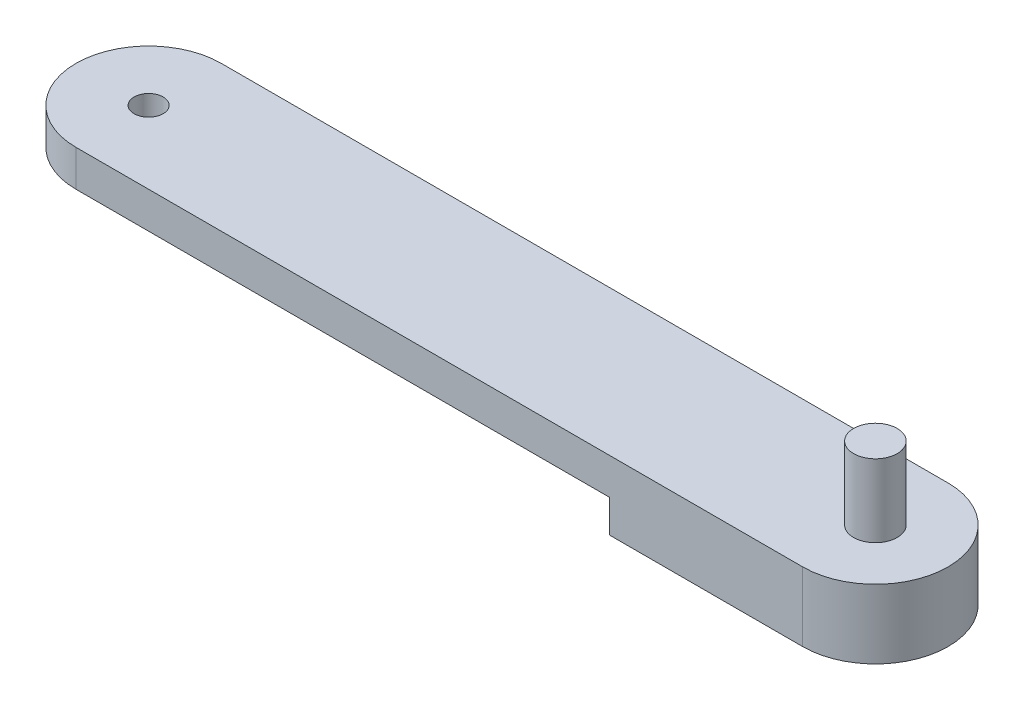
from build123d import *

# Parameters (mm, degrees)
SKETCH_1_R          = 2
EXTRUDE_1_DEPTH     = 5
SKETCH_2_R          = 3
EXTRUDE_2_DEPTH     = 10
EXTRUDE_START       = 4.5
EXTRUDE_3_DEPTH     = 4.5
CUT_EXTRUDE_1_DEPTH = 4.5


with BuildPart() as part:
    # 草图1 → 凸台-拉伸1 (new body)
    with BuildSketch(Plane(origin=(0, 0, 0), x_dir=(1, 0, 0), z_dir=(0, 1, 0))):
        with BuildLine():
            Line((0, 10), (100, 10))
            ThreePointArc((100, 10), (110, 0), (100, -10))
            Line((100, -10), (0, -10))
            ThreePointArc((0, -10), (-10, 0), (0, 10))
        make_face()
        with Locations(Location((0, 0, 0), (0, 0, 270))):
            Circle(SKETCH_1_R, mode=Mode.SUBTRACT)
    extrude(amount=EXTRUDE_1_DEPTH)

    # 草图2 → 凸台-拉伸2 (add)
    with BuildSketch(Plane(origin=(0, 5, 0), x_dir=(1, 0, 0), z_dir=(0, 1, 0))):
        with Locations(Location((100, 0, 0), (0, 0, 270))):
            Circle(SKETCH_2_R)
    extrude(amount=EXTRUDE_2_DEPTH)

    # 草图3 → 凸台-拉伸3 (add)
    with BuildSketch(Plane.XZ.offset(EXTRUDE_START)):
        with BuildLine():
            Line((100, 10), (73.40776322, 10))
            Line((73.40776322, 10), (73.40776322, -10))
            Line((73.40776322, -10), (100, -10))
            ThreePointArc((100, -10), (110, 0), (100, 10))
        make_face()
    extrude(amount=-EXTRUDE_3_DEPTH)

    # 草图4 → 切除-拉伸1 (cut)
    with BuildSketch(Plane.XZ.offset(4.5)):
        with BuildLine():
            Line((79.849230428, 2.288593229), (99.690178504, 3.236180981))
            ThreePointArc((99.690178504, 3.236180981), (103.250977807, 0), (99.690178504, -3.236180981))
            Line((99.690178504, -3.236180981), (79.849230428, -2.288593229))
            ThreePointArc((79.849230428, -2.288593229), (77.560637199, 0), (79.849230428, 2.288593229))
        make_face()
    extrude(amount=-CUT_EXTRUDE_1_DEPTH, mode=Mode.SUBTRACT)


solid = part.part
